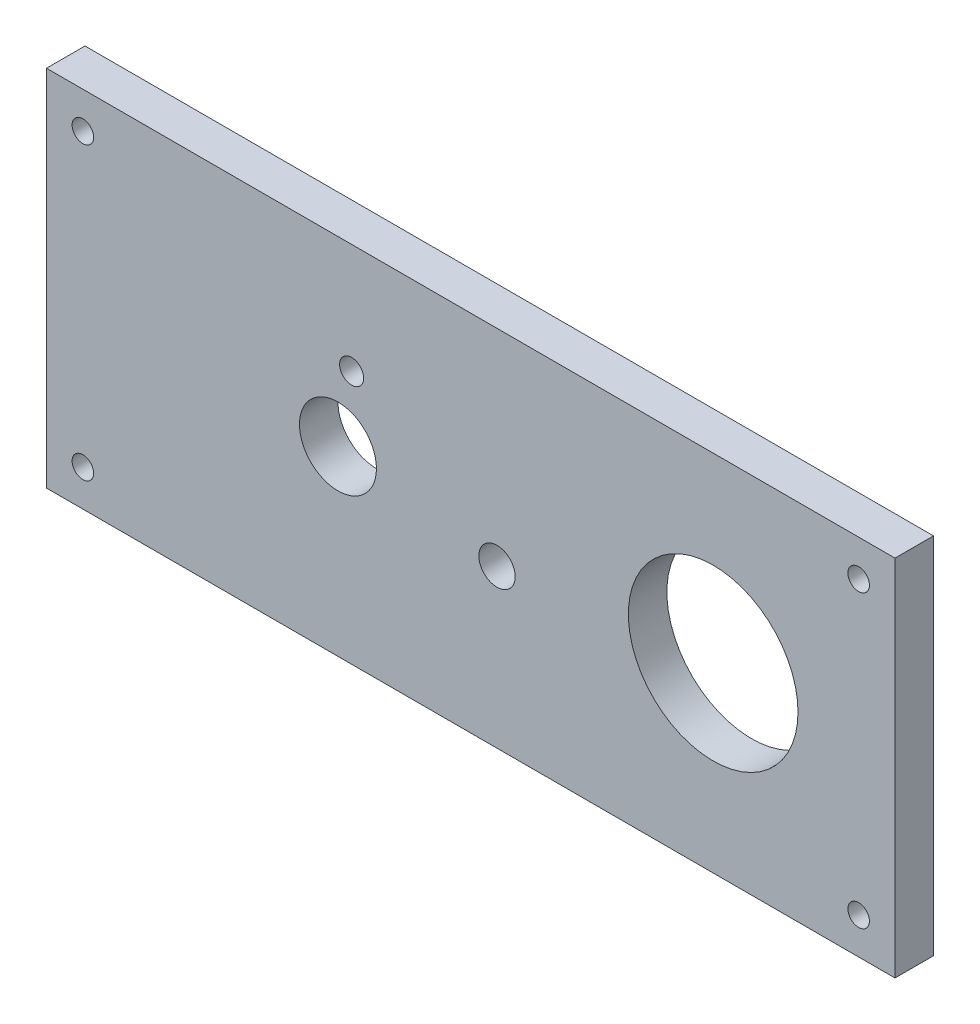
from build123d import *

# Parameters (mm, degrees)
SKETCH1_W             = 70
SKETCH1_H             = 30
SKETCH1_R             = 6.9977
SKETCH1_R_2           = 1.4986
SKETCH1_R_3           = 0.9906
BOSS_EXTRUDE2_DEPTH   = 3.175
F_2_56_TAPPED_HOLE1_D = 1.778
SKETCH4_R             = 3.175
CUT_EXTRUDE1_DEPTH    = 77.223884872


with BuildPart() as part:
    # Sketch1 → Boss-Extrude2 (new body)
    with BuildSketch(Plane.XY):
        with Locations((35, 15)):
            Rectangle(SKETCH1_W, SKETCH1_H)
        with Locations((55, 15)):
            Circle(SKETCH1_R, mode=Mode.SUBTRACT)
        with Locations((37.166699296, 13)):
            Circle(SKETCH1_R_2, mode=Mode.SUBTRACT)
        with Locations((25.169778966, 20.933400182)):
            Circle(SKETCH1_R_3, mode=Mode.SUBTRACT)
    extrude(amount=BOSS_EXTRUDE2_DEPTH)

    # #2-56 Tapped Hole1 (through all)
    with Locations(Plane.XY.offset(3.175)):
        with Locations((67, 27), (67, 3), (3, 27), (3, 3)):
            Hole(F_2_56_TAPPED_HOLE1_D / 2)

    # Sketch4 → Cut-Extrude1 (cut, through all)
    with BuildSketch(Plane.XY.offset(3.175)):
        with Locations((24.0438, 15)):
            Circle(SKETCH4_R)
    extrude(amount=-CUT_EXTRUDE1_DEPTH, mode=Mode.SUBTRACT)


solid = part.part
